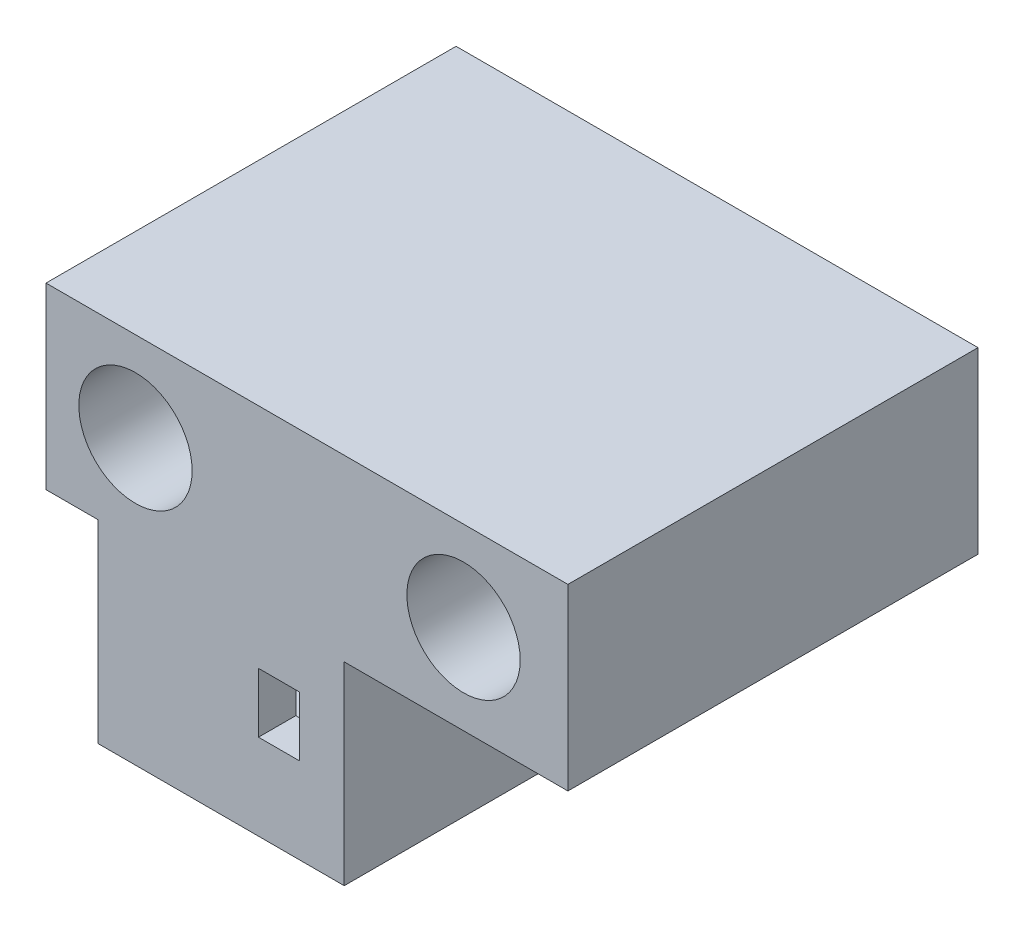
from build123d import *

# Parameters (mm, degrees)
ESQUISSE1_W             = 70
ESQUISSE1_H             = 24
BOSS_EXTRU_1_DEPTH      = 55
ESQUISSE2_R             = 7.6
ENL_V_MAT_EXTRU_1_DEPTH = 93.200867675
BOSS_EXTRU_3_DEPTH      = 21
ESQUISSE9_W             = 33
ESQUISSE9_H             = 55
BOSS_EXTRU_4_DEPTH      = 5
ESQUISSE10_R            = 1.5
ENL_V_MAT_EXTRU_4_DEPTH = 4
ESQUISSE11_W            = 5.5
ESQUISSE11_H            = 8
ENL_V_MAT_EXTRU_5_DEPTH = 10


with BuildPart() as part:
    # Esquisse1 → Boss.-Extru.1 (new body)
    with BuildSketch(Plane.XY):
        with Locations((35, 12)):
            Rectangle(ESQUISSE1_W, ESQUISSE1_H)
    extrude(amount=BOSS_EXTRU_1_DEPTH)

    # Esquisse2 → Enlèv. mat.-Extru.1 (cut, through all)
    with BuildSketch(Plane.XY):
        with Locations((56, 12)):
            Circle(ESQUISSE2_R)
        with Locations((12, 12)):
            Circle(ESQUISSE2_R)
    extrude(amount=ENL_V_MAT_EXTRU_1_DEPTH, mode=Mode.SUBTRACT)

    # Esquisse6 → Boss.-Extru.3 (add)
    with BuildSketch(Plane.XZ):
        Polygon((7, 0), (40, 0), (40, 55), (7, 55), (7, 50), (35, 50), (35, 5), (7, 5), align=None)
    extrude(amount=BOSS_EXTRU_3_DEPTH)

    # Esquisse9 → Boss.-Extru.4 (add)
    with BuildSketch(Plane.XZ.offset(21)):
        with Locations((23.5, 27.5)):
            Rectangle(ESQUISSE9_W, ESQUISSE9_H)
    extrude(amount=BOSS_EXTRU_4_DEPTH)

    # Esquisse10 → Enlèv. mat.-Extru.4 (cut)
    with BuildSketch(Plane.ZY.offset(-7)):
        with Locations((52.5, -16)):
            Circle(ESQUISSE10_R)
        with Locations((52.5, -5)):
            Circle(ESQUISSE10_R)
        with Locations((2.5, -16)):
            Circle(ESQUISSE10_R)
        with Locations((2.5, -5)):
            Circle(ESQUISSE10_R)
    extrude(amount=-ENL_V_MAT_EXTRU_4_DEPTH, mode=Mode.SUBTRACT)

    # Esquisse11 → Enlèv. mat.-Extru.5 (cut)
    with BuildSketch(Plane.XY.offset(55)):
        with Locations((31.25, -10.5)):
            Rectangle(ESQUISSE11_W, ESQUISSE11_H)
    extrude(amount=-ENL_V_MAT_EXTRU_5_DEPTH, mode=Mode.SUBTRACT)


solid = part.part
